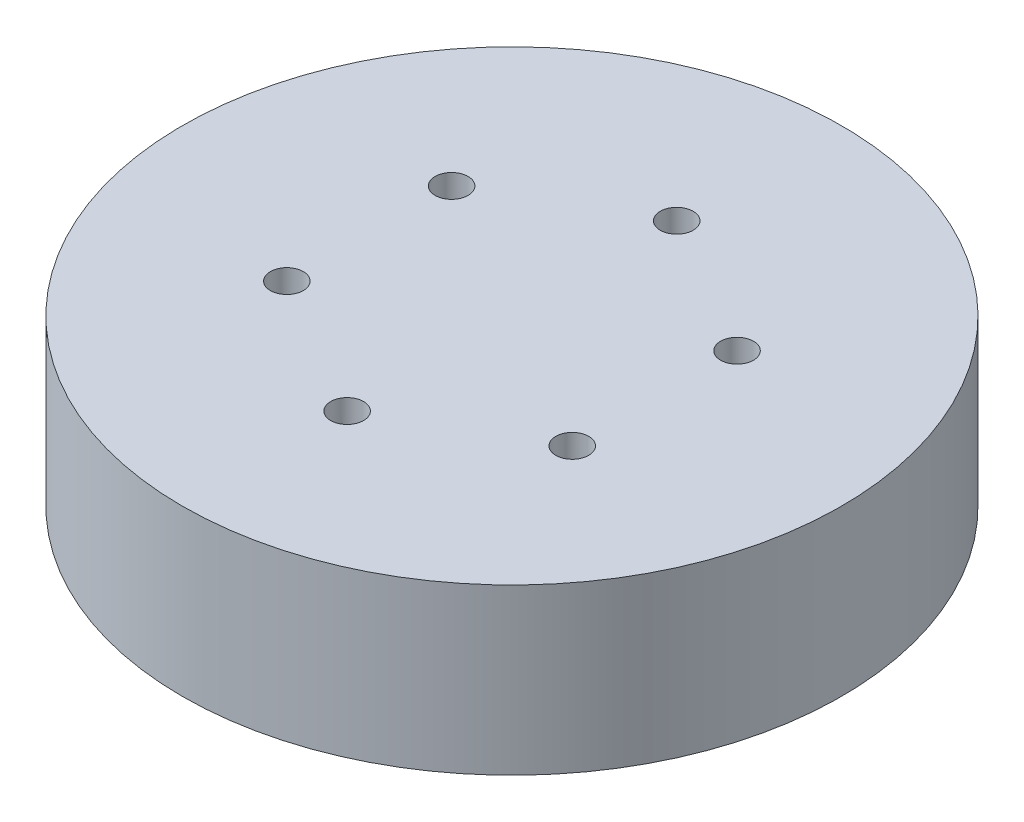
from build123d import *

# Parameters (mm, degrees)
SKETCH1_R           = 25.4
BOSS_EXTRUDE1_DEPTH = 12.7
SKETCH2_R           = 1.27
CUT_EXTRUDE1_DEPTH  = 6.35


with BuildPart() as part:
    # Sketch1 → Boss-Extrude1 (new body)
    with BuildSketch(Plane(origin=(0, 0, 0), x_dir=(1, 0, 0), z_dir=(0, 1, 0))):
        with Locations(Location((0, 0, 0), (0, 0, 270))):
            Circle(SKETCH1_R)
    extrude(amount=BOSS_EXTRUDE1_DEPTH)

    # Sketch2 → Cut-Extrude1 (cut)
    with BuildSketch(Plane(origin=(0, 12.7, 0), x_dir=(1, 0, 0), z_dir=(0, 1, 0))):
        with Locations(Location((0, 12.7, 0), (0, 0, 270))):
            Circle(SKETCH2_R)
        with Locations(Location((10.998522628, 6.35, 0), (0, 0, 270))):
            Circle(SKETCH2_R)
        with Locations(Location((10.998522628, -6.35, 0), (0, 0, 270))):
            Circle(SKETCH2_R)
        with Locations(Location((0, -12.7, 0), (0, 0, 270))):
            Circle(SKETCH2_R)
        with Locations(Location((-10.998522628, -6.35, 0), (0, 0, 270))):
            Circle(SKETCH2_R)
        with Locations(Location((-10.998522628, 6.35, 0), (0, 0, 270))):
            Circle(SKETCH2_R)
    extrude(amount=-CUT_EXTRUDE1_DEPTH, mode=Mode.SUBTRACT)


solid = part.part
